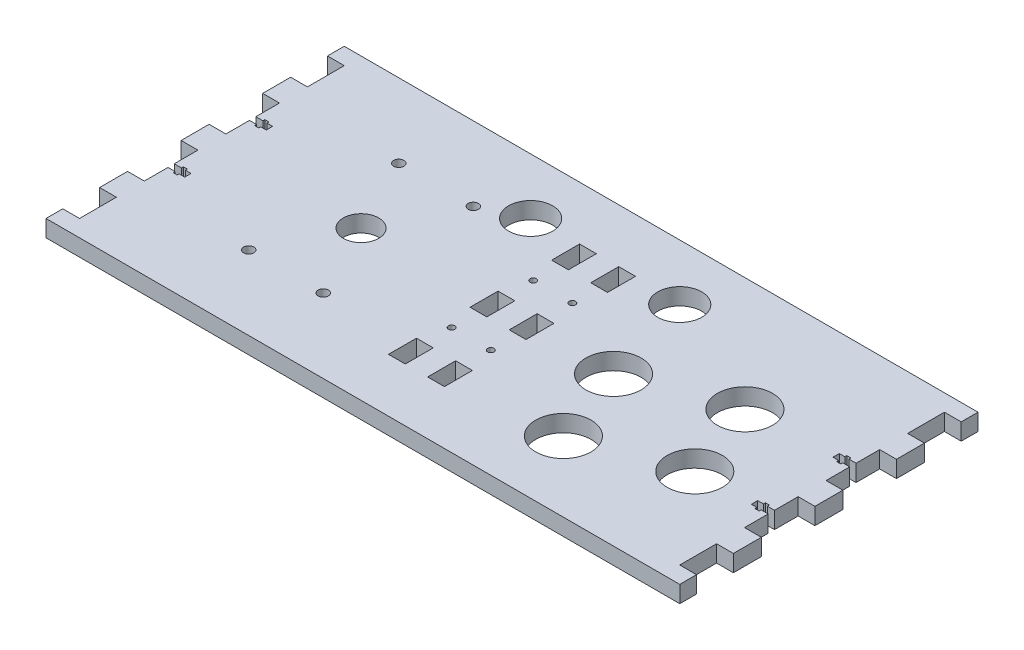
from build123d import *

# Parameters (mm, degrees)
SKETCH1_W           = 160
SKETCH1_H           = 160
BOSS_EXTRUDE1_DEPTH = 9
SKETCH2_W           = 9
SKETCH2_H           = 15
SKETCH2_H_2         = 9
BOSS_EXTRUDE2_DEPTH = 9
SKETCH3_R           = 1.7
SKETCH3_W           = 9
SKETCH3_H           = 15
CUT_EXTRUDE1_DEPTH  = 121.008333044
CUT_EXTRUDE2_DEPTH  = 121.008333044
SKETCH5_R           = 9.5
SKETCH5_R_2         = 2.75
CUT_EXTRUDE3_DEPTH  = 121.008333044
SKETCH6_W           = 160
SKETCH6_H           = 9
BOSS_EXTRUDE3_DEPTH = 1
SKETCH7_R           = 11.8
CUT_EXTRUDE4_DEPTH  = 121.008333044
SKETCH8_R           = 14.825
CUT_EXTRUDE5_DEPTH  = 264.594385373


with BuildPart() as part:
    # Sketch1 → Boss-Extrude1 (new body)
    with BuildSketch(Plane(origin=(0, 0, 0), x_dir=(1, 0, 0), z_dir=(0, 1, 0))):
        Rectangle(SKETCH1_W, SKETCH1_H)
    boss_extrude1 = extrude(amount=BOSS_EXTRUDE1_DEPTH)

    # Sketch2 → Boss-Extrude2 (add)
    with BuildSketch(Plane(origin=(0, 9, 0), x_dir=(1, 0, 0), z_dir=(0, 1, 0))):
        with Locations((-84.5, 0)):
            Rectangle(SKETCH2_W, SKETCH2_H)
        with Locations((-84.5, 43.75)):
            Rectangle(SKETCH2_W, SKETCH2_H)
        with Locations((-84.5, -43.75)):
            Rectangle(SKETCH2_W, SKETCH2_H)
        with Locations((-84.5, 75.5)):
            Rectangle(SKETCH2_W, SKETCH2_H_2)
        with Locations((-84.5, -75.5)):
            Rectangle(SKETCH2_W, SKETCH2_H_2)
    boss_extrude2 = extrude(amount=-BOSS_EXTRUDE2_DEPTH)

    # Sketch3 → Cut-Extrude1 (cut, through all)
    with BuildSketch(Plane(origin=(0, 9, 0), x_dir=(1, 0, 0), z_dir=(0, 1, 0))):
        with Locations(Location((70.5, 21.875, 0), (0, 0, 270))):
            Circle(SKETCH3_R)
        with Locations(Location((70.5, -21.875, 0), (0, 0, 270))):
            Circle(SKETCH3_R)
        with Locations((70.5, 43.75)):
            Rectangle(SKETCH3_W, SKETCH3_H)
        with Locations((70.5, 0)):
            Rectangle(SKETCH3_W, SKETCH3_H)
        with Locations((70.5, -43.75)):
            Rectangle(SKETCH3_W, SKETCH3_H)
    cut_extrude1 = extrude(amount=-CUT_EXTRUDE1_DEPTH, mode=Mode.SUBTRACT)

    # Sketch4 → Cut-Extrude2 (cut, through all)
    with BuildSketch(Plane(origin=(0, 9, 0), x_dir=(1, 0, 0), z_dir=(0, 1, 0))):
        Polygon((-80, 23.575), (-76.2, 23.575), (-76.2, 24.625), (-74, 24.625), (-74, 23.575), (-71, 23.575), (-71, 20.175), (-74, 20.175), (-74, 19.125), (-76.2, 19.125), (-76.2, 20.175), (-80, 20.175), align=None)
        Polygon((-80, -23.575), (-80, -20.175), (-76.2, -20.175), (-76.2, -19.125), (-74, -19.125), (-74, -20.175), (-71, -20.175), (-71, -23.575), (-74, -23.575), (-74, -24.625), (-76.2, -24.625), (-76.2, -23.575), align=None)
    cut_extrude2 = extrude(amount=-CUT_EXTRUDE2_DEPTH, mode=Mode.SUBTRACT)

    # Sketch5 → Cut-Extrude3 (cut, through all)
    with BuildSketch(Plane(origin=(0, 9, 0), x_dir=(1, 0, 0), z_dir=(0, 1, 0))):
        with Locations(Location((0, 0, 0), (0, 0, 270))):
            Circle(SKETCH5_R)
        with Locations(Location((-20, 40.25, 0), (0, 0, 270))):
            Circle(SKETCH5_R_2)
        with Locations(Location((20, 40.25, 0), (0, 0, 270))):
            Circle(SKETCH5_R_2)
        with Locations(Location((20, -40.25, 0), (0, 0, 270))):
            Circle(SKETCH5_R_2)
        with Locations(Location((-20, -40.25, 0), (0, 0, 270))):
            Circle(SKETCH5_R_2)
    extrude(amount=-CUT_EXTRUDE3_DEPTH, mode=Mode.SUBTRACT)

    # Sketch6 → Boss-Extrude3 (add)
    with BuildSketch(Plane(origin=(80, 0, 0), x_dir=(0, 0, -1), z_dir=(1, 0, 0))):
        with Locations((0, 4.5)):
            Rectangle(SKETCH6_W, SKETCH6_H)
    boss_extrude3 = extrude(amount=BOSS_EXTRUDE3_DEPTH)

    # Sketch7 → Cut-Extrude4 (cut, through all)
    with BuildSketch(Plane(origin=(0, 9, 0), x_dir=(1, 0, 0), z_dir=(0, 1, 0))):
        with Locations(Location((41, 50, 0), (0, 0, 270))):
            Circle(SKETCH7_R)
    cut_extrude4 = extrude(amount=-CUT_EXTRUDE4_DEPTH, mode=Mode.SUBTRACT)

    # Mirror1: Boss-Extrude1, Boss-Extrude2, Cut-Extrude1, Cut-Extrude2, Boss-Extrude3, Cut-Extrude4 across plane
    add(boss_extrude1.mirror(Plane.ZY.offset(-81)))
    add(boss_extrude2.mirror(Plane.ZY.offset(-81)))
    add(cut_extrude1.mirror(Plane.ZY.offset(-81)), mode=Mode.SUBTRACT)
    add(cut_extrude2.mirror(Plane.ZY.offset(-81)), mode=Mode.SUBTRACT)
    add(boss_extrude3.mirror(Plane.ZY.offset(-81)))
    add(cut_extrude4.mirror(Plane.ZY.offset(-81)), mode=Mode.SUBTRACT)

    # Sketch8 → Cut-Extrude5 (cut, through all)
    with BuildSketch(Plane(origin=(0, 9, 0), x_dir=(1, 0, 0), z_dir=(0, 1, 0))):
        with Locations(Location((135.462999704, 0, 0), (0, 0, 270))):
            Circle(SKETCH8_R)
        with Locations(Location((187.146093847, 18.811107883, 0), (0, 0, 270))):
            Circle(SKETCH8_R)
        with Locations(Location((202.537000296, -23.475060052, 0), (0, 0, 270))):
            Circle(SKETCH8_R)
        with Locations(Location((150.853906153, -42.286167935, 0), (0, 0, 270))):
            Circle(SKETCH8_R)
    extrude(amount=-CUT_EXTRUDE5_DEPTH, mode=Mode.SUBTRACT)


solid = part.part
